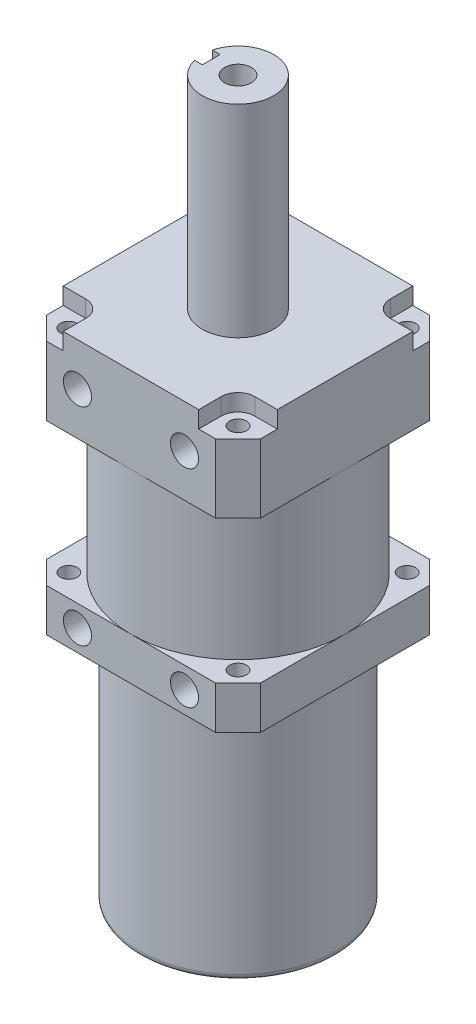
from build123d import *

# Parameters (mm, degrees)
SALIENTE_EXTRUIR1_DEPTH = 15.24
CROQUIS2_R              = 6.35
SALIENTE_EXTRUIR2_DEPTH = 36
CORTAR_EXTRUIR1_DEPTH   = 1.585
CROQUIS4_R              = 1.5
CORTAR_EXTRUIR2_DEPTH   = 58.890781738
CROQUIS5_R              = 19.05
SALIENTE_EXTRUIR3_DEPTH = 25.4
SALIENTE_EXTRUIR4_START = 7.62
CROQUIS6_R              = 1.5
SALIENTE_EXTRUIR4_DEPTH = 7.62
CORTAR_EXTRUIR3_DEPTH   = 3
REDONDEO1_R             = 3
CROQUIS8_R              = 17.5
SALIENTE_EXTRUIR5_DEPTH = 43
REDONDEO2_R             = 1
CROQUIS9_R              = 2.5
CORTAR_EXTRUIR4_DEPTH   = 10
CORTAR_EXTRUIR5_START   = 28.1
CROQUIS9_2_R            = 2.5
CORTAR_EXTRUIR5_DEPTH   = 10
CROQUIS10_R             = 2.3840625
CORTAR_EXTRUIR6_DEPTH   = 15


with BuildPart() as part:
    # Croquis1 → Saliente-Extruir1 (new body)
    with BuildSketch(Plane(origin=(0, 0, 0), x_dir=(1, 0, 0), z_dir=(0, 1, 0))):
        Polygon((-15.05, 19.05), (-19.05, 15.05), (-19.05, -15.05), (-15.05, -19.05), (15.05, -19.05), (19.05, -15.05), (19.05, 15.05), (15.05, 19.05), align=None)
    extrude(amount=SALIENTE_EXTRUIR1_DEPTH)

    # Croquis2 → Saliente-Extruir2 (add)
    with BuildSketch(Plane(origin=(0, 15.24, 0), x_dir=(1, 0, 0), z_dir=(0, 1, 0))):
        with Locations(Location((0, 0, 0), (0, 0, 270))):
            Circle(CROQUIS2_R)
    extrude(amount=SALIENTE_EXTRUIR2_DEPTH)

    # Croquis3 → Cortar-Extruir1 (cut)
    with BuildSketch(Plane.ZY.offset(6.35)):
        with BuildLine():
            Line((-1.5875, 51.24), (-1.5875, 19.49))
            ThreePointArc((-1.5875, 19.49), (-0.0025, 17.905), (1.5825, 19.49))
            Line((1.5825, 19.49), (1.5825, 51.24))
            Line((1.5825, 51.24), (-1.5875, 51.24))
        make_face()
    extrude(amount=-CORTAR_EXTRUIR1_DEPTH, mode=Mode.SUBTRACT)

    # Croquis4 → Cortar-Extruir2 (cut, through all)
    with BuildSketch(Plane.XZ):
        with Locations(Location((-15.05, -15.05, 0), (0, 0, 270))):
            Circle(CROQUIS4_R)
        with Locations(Location((-15.05, 15.05, 0), (0, 0, 270))):
            Circle(CROQUIS4_R)
        with Locations(Location((15.05, 15.05, 0), (0, 0, 270))):
            Circle(CROQUIS4_R)
        with Locations(Location((15.05, -15.05, 0), (0, 0, 270))):
            Circle(CROQUIS4_R)
    extrude(amount=-CORTAR_EXTRUIR2_DEPTH, mode=Mode.SUBTRACT)

    # Croquis5 → Saliente-Extruir3 (add)
    with BuildSketch(Plane.XZ):
        with Locations(Location((0, 0, 0), (0, 0, 270))):
            Circle(CROQUIS5_R)
    extrude(amount=SALIENTE_EXTRUIR3_DEPTH)

    # Croquis6 → Saliente-Extruir4 (add)
    with BuildSketch(Plane.XZ.offset(25.4).offset(SALIENTE_EXTRUIR4_START)):
        Polygon((-19.05, -15.05), (-15.05, -19.05), (15.05, -19.05), (19.05, -15.05), (19.05, 15.05), (15.05, 19.05), (-15.05, 19.05), (-19.05, 15.05), align=None)
        with Locations(Location((-15.05, 15.05, 0), (0, 0, 270))):
            Circle(CROQUIS6_R, mode=Mode.SUBTRACT)
        with Locations(Location((-15.05, -15.05, 0), (0, 0, 270))):
            Circle(CROQUIS6_R, mode=Mode.SUBTRACT)
        with Locations(Location((15.05, -15.05, 0), (0, 0, 270))):
            Circle(CROQUIS6_R, mode=Mode.SUBTRACT)
        with Locations(Location((15.05, 15.05, 0), (0, 0, 270))):
            Circle(CROQUIS6_R, mode=Mode.SUBTRACT)
    extrude(amount=-SALIENTE_EXTRUIR4_DEPTH)

    # Croquis7 → Cortar-Extruir3 (cut)
    with BuildSketch(Plane(origin=(0, 15.24, 0), x_dir=(1, 0, 0), z_dir=(0, 1, 0))):
        Polygon((-19.05, -12.05), (-12.05, -12.05), (-12.05, -19.05), (-15.05, -19.05), (-19.05, -15.05), align=None)
        Polygon((-12.05, 19.05), (-12.05, 12.05), (-19.05, 12.05), (-19.05, 15.05), (-15.05, 19.05), align=None)
        Polygon((19.05, 12.05), (12.05, 12.05), (12.05, 19.05), (15.05, 19.05), (19.05, 15.05), align=None)
        Polygon((12.05, -19.05), (12.05, -12.05), (19.05, -12.05), (19.05, -15.05), (15.05, -19.05), align=None)
    extrude(amount=-CORTAR_EXTRUIR3_DEPTH, mode=Mode.SUBTRACT)

    # Redondeo1
    redondeo1_edges = [part.edges().sort_by_distance(p)[0] for p in [
        (12.05, 13.74, 12.05),
        (12.05, 13.74, -12.05),
        (-12.05, 13.74, -12.05),
        (-12.05, 13.74, 12.05),
    ]]
    fillet(redondeo1_edges, radius=REDONDEO1_R)

    # Croquis8 → Saliente-Extruir5 (add)
    with BuildSketch(Plane.XZ.offset(33.02)):
        with Locations(Location((0, 0, 0), (0, 0, 270))):
            Circle(CROQUIS8_R)
    extrude(amount=SALIENTE_EXTRUIR5_DEPTH)

    # Redondeo2
    redondeo2_edges = [part.edges().sort_by_distance(p)[0] for p in [
        (0, -76.02, 17.5),
    ]]
    fillet(redondeo2_edges, radius=REDONDEO2_R)

    # Croquis9 → Cortar-Extruir4 (cut)
    with BuildSketch(Plane(origin=(0, 0, 19.05), x_dir=(-1, 0, 0), z_dir=(0, 0, -1))):
        with Locations((9.525, 7.62)):
            Circle(CROQUIS9_R)
        with Locations((-9.525, 7.62)):
            Circle(CROQUIS9_R)
        with Locations((-9.525, -29.21)):
            Circle(CROQUIS9_R)
        with Locations((9.525, -29.21)):
            Circle(CROQUIS9_R)
    extrude(amount=CORTAR_EXTRUIR4_DEPTH, mode=Mode.SUBTRACT)

    # Croquis9<2> → Cortar-Extruir5 (cut)
    with BuildSketch(Plane(origin=(0, 0, 19.05), x_dir=(-1, 0, 0), z_dir=(0, 0, -1)).offset(CORTAR_EXTRUIR5_START)):
        with Locations((9.525, 7.62)):
            Circle(CROQUIS9_2_R)
        with Locations((-9.525, 7.62)):
            Circle(CROQUIS9_2_R)
        with Locations((-9.525, -29.21)):
            Circle(CROQUIS9_2_R)
        with Locations((9.525, -29.21)):
            Circle(CROQUIS9_2_R)
    extrude(amount=CORTAR_EXTRUIR5_DEPTH, mode=Mode.SUBTRACT)

    # Croquis10 → Cortar-Extruir6 (cut)
    with BuildSketch(Plane(origin=(0, 51.24, 0), x_dir=(1, 0, 0), z_dir=(0, 1, 0))):
        with Locations(Location((0, 0, 0), (0, 0, 270))):
            Circle(CROQUIS10_R)
    extrude(amount=-CORTAR_EXTRUIR6_DEPTH, mode=Mode.SUBTRACT)


solid = part.part
